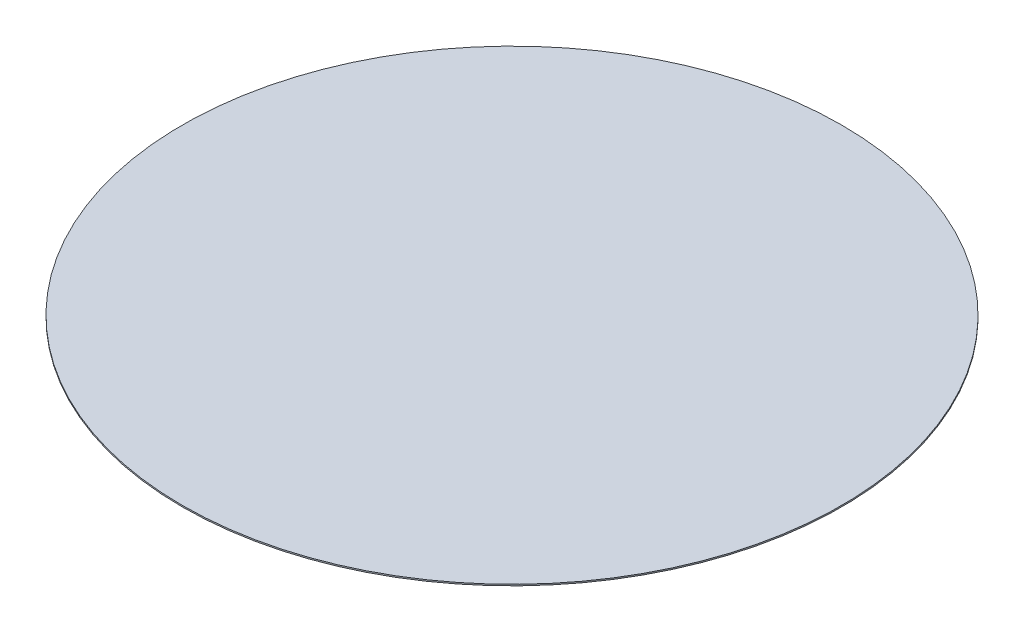
from build123d import *

# Parameters (mm, degrees)
SKETCH1_R           = 24
BOSS_EXTRUDE1_DEPTH = 0.1


with BuildPart() as part:
    # Sketch1 → Boss-Extrude1 (new body)
    with BuildSketch(Plane(origin=(0, 0, 0), x_dir=(1, 0, 0), z_dir=(0, 1, 0))):
        with Locations(Location((0, 0, 0), (0, 0, 270))):
            Circle(SKETCH1_R)
    extrude(amount=BOSS_EXTRUDE1_DEPTH)


solid = part.part
